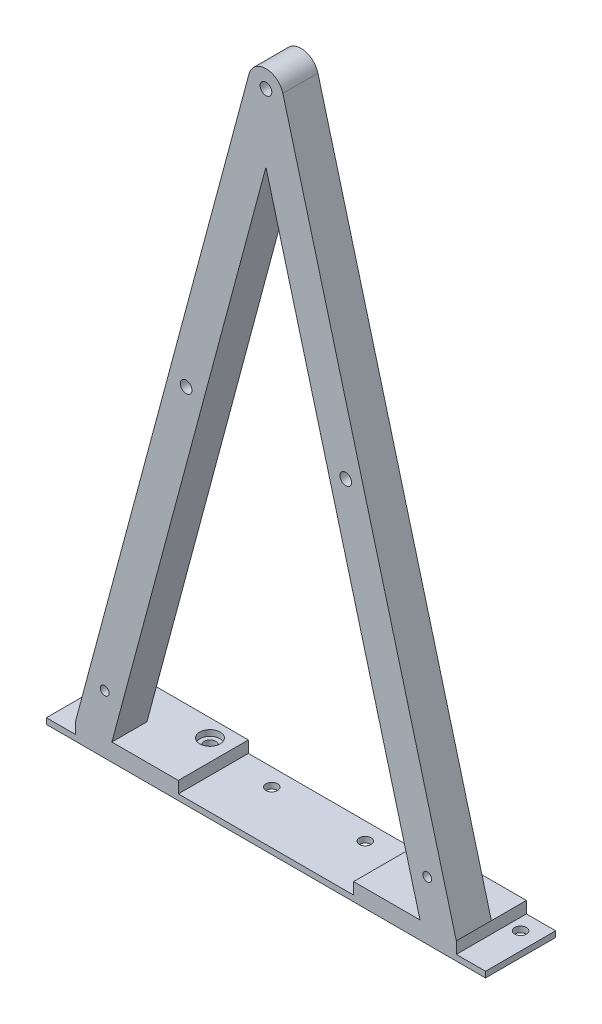
from build123d import *

# Parameters (mm, degrees)
SKETCH_1_R          = 1
EXTRUDE_1_DEPTH     = 6
SKETCH_2_R          = 1.75
CUT_EXTRUDE_1_DEPTH = 4
SKETCH_3_W          = 75.160479418
SKETCH_3_H          = 12
EXTRUDE_2_DEPTH     = 3
SKETCH_4_R          = 0.75
CUT_EXTRUDE_2_DEPTH = 3
SKETCH_5_W          = 5
SKETCH_5_H          = 12
SKETCH_5_W_2        = 30
CUT_EXTRUDE_3_DEPTH = 2
SKETCH_6_R          = 1
CUT_EXTRUDE_4_DEPTH = 120.23621269
SKETCH_6_3_R        = 1
SKETCH_6_3_R_2      = 1.75
CUT_EXTRUDE_5_DEPTH = 1


with BuildPart() as part:
    # 草图1 → 凸台-拉伸1 (new body)
    with BuildSketch(Plane.XY):
        with BuildLine():
            Line((0, -11.591109915), (26.368582626, -110))
            Line((26.368582626, -110), (32.580239709, -110))
            Line((32.580239709, -110), (2.897777479, 0.776457135))
            ThreePointArc((2.897777479, 0.776457135), (0, 3), (-2.897777479, 0.776457135))
            Line((-2.897777479, 0.776457135), (-32.580239709, -110))
            Line((-32.580239709, -110), (-26.368582626, -110))
            Line((-26.368582626, -110), (0, -11.591109915))
        make_face()
        with Locations((13.665408814, -51)):
            Circle(SKETCH_1_R, mode=Mode.SUBTRACT)
        Circle(SKETCH_1_R, mode=Mode.SUBTRACT)
        with Locations((-13.665408814, -51)):
            Circle(SKETCH_1_R, mode=Mode.SUBTRACT)
    extrude(amount=EXTRUDE_1_DEPTH)

    # 草图2 → 切除-拉伸1 (cut)
    with BuildSketch(Plane(origin=(0, 0, 0), x_dir=(-1, 0, 0), z_dir=(0, 0, -1))):
        Circle(SKETCH_2_R)
        with Locations((13.665408814, -51)):
            Circle(SKETCH_2_R)
        with Locations((-13.665408814, -51)):
            Circle(SKETCH_2_R)
    extrude(amount=-CUT_EXTRUDE_1_DEPTH, mode=Mode.SUBTRACT)

    # 草图3 → 凸台-拉伸2 (add)
    with BuildSketch(Plane.XZ.offset(110)):
        Rectangle(SKETCH_3_W, SKETCH_3_H)
    extrude(amount=EXTRUDE_2_DEPTH)

    # 草图4 → 切除-拉伸2 (cut)
    with BuildSketch(Plane.XY.offset(6)):
        with Locations((-27.59876682, -103)):
            Circle(SKETCH_4_R)
        with Locations((27.59876682, -103)):
            Circle(SKETCH_4_R)
    extrude(amount=-CUT_EXTRUDE_2_DEPTH, mode=Mode.SUBTRACT)

    # 草图5 → 切除-拉伸3 (cut)
    with BuildSketch(Plane(origin=(0, -110, 0), x_dir=(1, 0, 0), z_dir=(0, 1, 0))):
        with Locations((-35.080239709, 0)):
            Rectangle(SKETCH_5_W, SKETCH_5_H)
        with Locations((35.080239709, 0)):
            Rectangle(SKETCH_5_W, SKETCH_5_H)
        Rectangle(SKETCH_5_W_2, SKETCH_5_H)
    extrude(amount=-CUT_EXTRUDE_3_DEPTH, mode=Mode.SUBTRACT)

    # 草图6 → 切除-拉伸4 (cut, through all)
    with BuildSketch(Plane(origin=(0, -110, 0), x_dir=(1, 0, 0), z_dir=(0, 1, 0))):
        with Locations(Location((-8, 3, 0), (0, 0, 270))):
            Circle(SKETCH_6_R)
        with Locations(Location((-34.580239709, 3, 0), (0, 0, 270))):
            Circle(SKETCH_6_R)
        with Locations(Location((-18.580239709, 3, 0), (0, 0, 270))):
            Circle(SKETCH_6_R)
        with Locations(Location((8, 3, 0), (0, 0, 270))):
            Circle(SKETCH_6_R)
        with Locations(Location((18.580239709, 3, 0), (0, 0, 270))):
            Circle(SKETCH_6_R)
        with Locations(Location((34.580239709, 3, 0), (0, 0, 270))):
            Circle(SKETCH_6_R)
    extrude(amount=-CUT_EXTRUDE_4_DEPTH, mode=Mode.SUBTRACT)

    # 草图6<3> → 切除-拉伸5 (cut)
    # profile 1 of 6: a face of its own
    with BuildSketch(Plane(origin=(0, -110, 0), x_dir=(1, 0, 0), z_dir=(0, 1, 0))):
        with Locations(Location((-34.580239709, 3, 0), (0, 0, 270))):
            Circle(SKETCH_6_3_R)
    # profile 2 of 6: a face of its own
    with BuildSketch(Plane(origin=(0, -110, 0), x_dir=(1, 0, 0), z_dir=(0, 1, 0))):
        with Locations(Location((-8, 3, 0), (0, 0, 270))):
            Circle(SKETCH_6_3_R)
    # profile 3 of 6: a face of its own
    with BuildSketch(Plane(origin=(0, -110, 0), x_dir=(1, 0, 0), z_dir=(0, 1, 0))):
        with Locations(Location((8, 3, 0), (0, 0, 270))):
            Circle(SKETCH_6_3_R)
    # profile 4 of 6: a face of its own
    with BuildSketch(Plane(origin=(0, -110, 0), x_dir=(1, 0, 0), z_dir=(0, 1, 0))):
        with Locations(Location((34.580239709, 3, 0), (0, 0, 270))):
            Circle(SKETCH_6_3_R)
    # profile 5 of 6: a face of its own
    with BuildSketch(Plane(origin=(0, -110, 0), x_dir=(1, 0, 0), z_dir=(0, 1, 0))):
        with Locations(Location((18.580239709, 3, 0), (0, 0, 270))):
            Circle(SKETCH_6_3_R_2)
        with Locations(Location((18.580239709, 3, 0), (0, 0, 270))):
            Circle(SKETCH_6_3_R, mode=Mode.SUBTRACT)
    # profile 6 of 6: a face of its own
    with BuildSketch(Plane(origin=(0, -110, 0), x_dir=(1, 0, 0), z_dir=(0, 1, 0))):
        with Locations(Location((-18.580239709, 3, 0), (0, 0, 270))):
            Circle(SKETCH_6_3_R_2)
        with Locations(Location((-18.580239709, 3, 0), (0, 0, 270))):
            Circle(SKETCH_6_3_R, mode=Mode.SUBTRACT)
    extrude(amount=-CUT_EXTRUDE_5_DEPTH, mode=Mode.SUBTRACT)


solid = part.part
